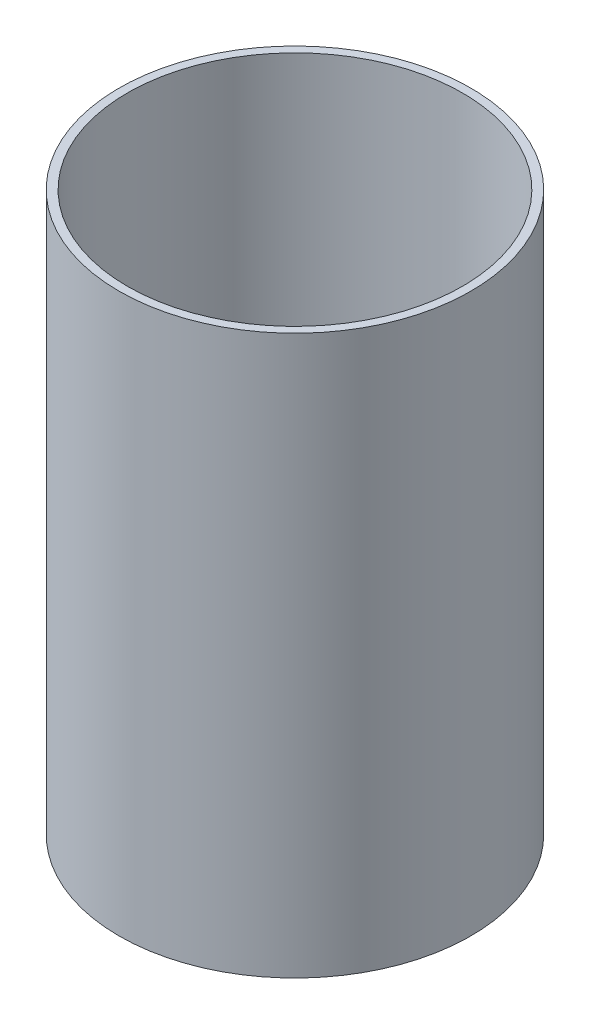
from build123d import *

# Parameters (mm, degrees)
ESQUISSE1_R        = 31.5
ESQUISSE1_R_2      = 30
BOSS_EXTRU_1_DEPTH = 100


with BuildPart() as part:
    # Esquisse1 → Boss.-Extru.1 (new body)
    with BuildSketch(Plane(origin=(0, 0, 0), x_dir=(1, 0, 0), z_dir=(0, 1, 0))):
        with Locations(Location((0, 0, 0), (0, 0, 270))):
            Circle(ESQUISSE1_R)
        with Locations(Location((0, 0, 0), (0, 0, 270))):
            Circle(ESQUISSE1_R_2, mode=Mode.SUBTRACT)
    extrude(amount=BOSS_EXTRU_1_DEPTH)


solid = part.part
